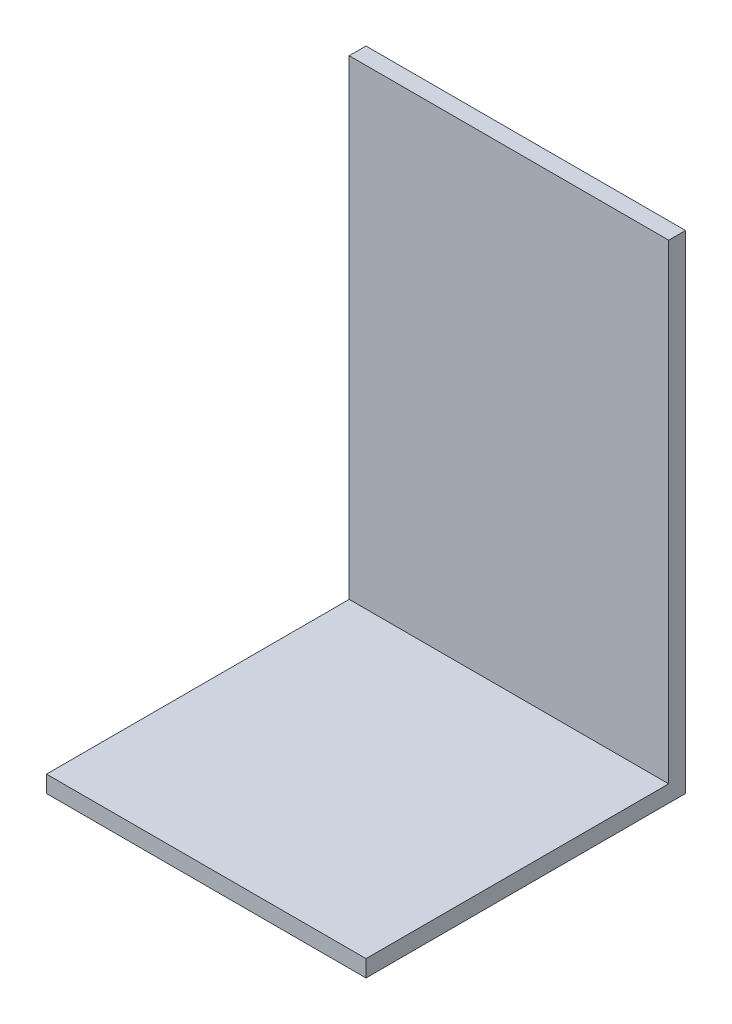
from build123d import *

# Parameters (mm, degrees)
SKETCH1_W           = 38
SKETCH1_H           = 38
BOSS_EXTRUDE1_DEPTH = 2
SKETCH2_W           = 38
SKETCH2_H           = 2
BOSS_EXTRUDE2_DEPTH = 56


with BuildPart() as part:
    # Sketch1 → Boss-Extrude1 (new body)
    with BuildSketch(Plane(origin=(0, 0, 0), x_dir=(1, 0, 0), z_dir=(0, 1, 0))):
        with Locations((-13.081650622, 15.738235294)):
            Rectangle(SKETCH1_W, SKETCH1_H)
    extrude(amount=BOSS_EXTRUDE1_DEPTH)

    # Sketch2 → Boss-Extrude2 (add)
    with BuildSketch(Plane(origin=(0, 2, 0), x_dir=(1, 0, 0), z_dir=(0, 1, 0))):
        with Locations((-13.081650622, 33.738235294)):
            Rectangle(SKETCH2_W, SKETCH2_H)
    extrude(amount=BOSS_EXTRUDE2_DEPTH)


solid = part.part
